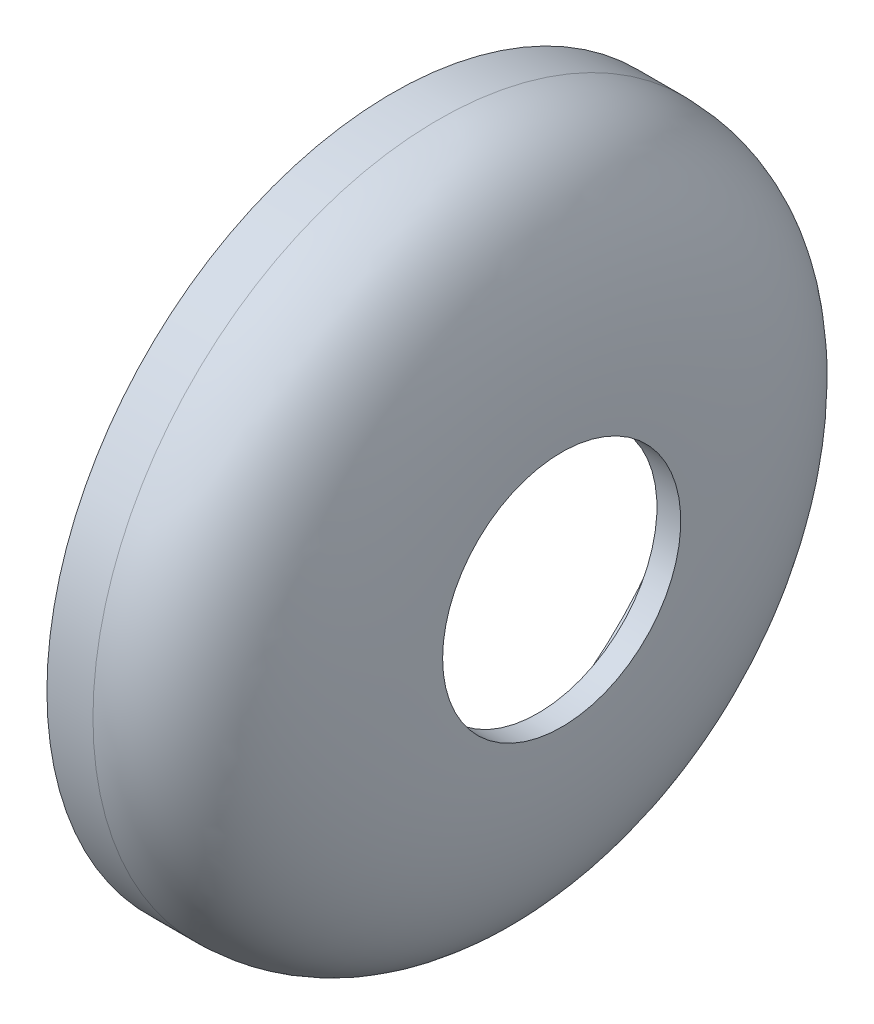
from build123d import *


with BuildPart() as part:
    # Sketch1 → Revolve1 (revolve)
    with BuildSketch(Plane.XY, mode=Mode.PRIVATE) as revolve1_sk:
        with BuildLine():
            Line((0, 27), (0, 29))
            Line((0, 29), (3.865532232, 29))
            add(Edge.make_bspline(
                [(3.865532232, 29), (14.23, 29), (14.23, 10)],
                knots=[0, 0, 0, 1, 1, 1], degree=2))
            Line((14.23, 10), (12.23, 10))
            add(Edge.make_bspline(
                [(3.865532232, 27), (12.23, 27), (12.23, 10)],
                knots=[0, 0, 0, 1, 1, 1], degree=2))
            Line((3.865532232, 27), (0, 27))
        make_face()
    revolve(revolve1_sk.sketch.rotate(Axis((-5.327300874, 0, 0), (1, 0, 0)), 90), axis=Axis((-5.327300874, 0, 0), (1, 0, 0)))


solid = part.part
